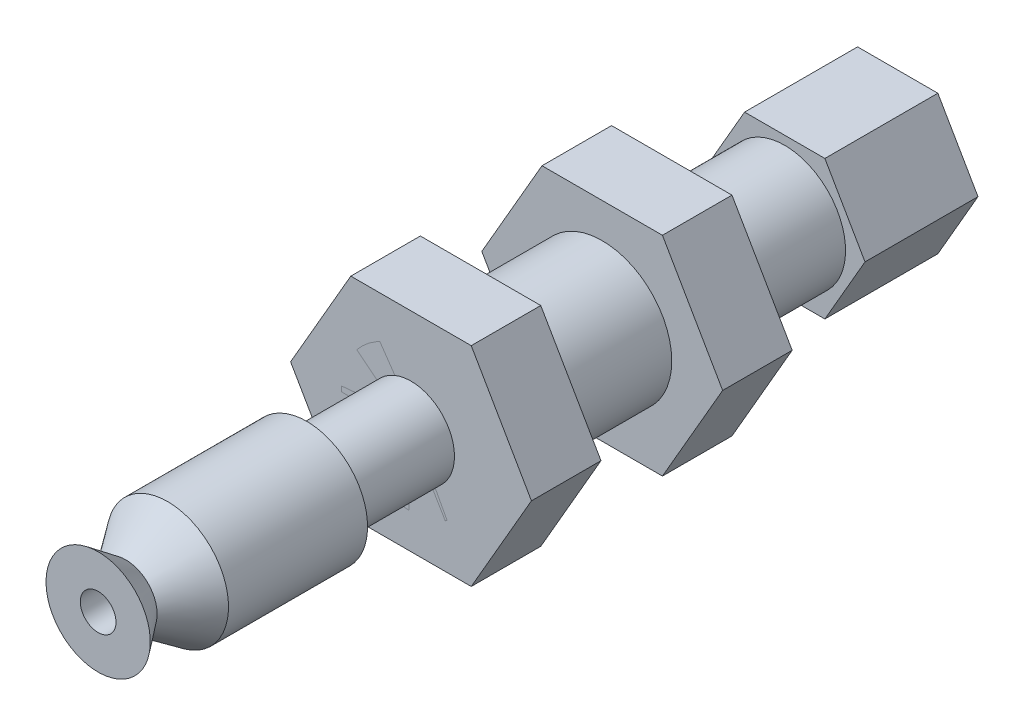
from build123d import *

# Parameters (mm, degrees)
SKETCH_1_R          = 3.5
EXTRUDE_1_DEPTH     = 6.5
EXTRUDE_2_DEPTH     = 6.5
SKETCH_3_R          = 4
EXTRUDE_3_DEPTH     = 15
EXTRUDE_4_DEPTH     = 4
EXTRUDE_5_DEPTH     = 4
SKETCH_6_R          = 2.5
EXTRUDE_6_DEPTH     = 6
SKETCH_10_R         = 1.026794083
CUT_EXTRUDE_1_DEPTH = 47.904157598


with BuildPart() as part:
    # 草图1 → 凸台-拉伸1 (new body)
    with BuildSketch(Plane.XY):
        Circle(SKETCH_1_R)
    extrude(amount=EXTRUDE_1_DEPTH)

    # 草图2 → 凸台-拉伸2 (add)
    with BuildSketch(Plane(origin=(0, 0, 0), x_dir=(-1, 0, 0), z_dir=(0, 0, -1))):
        Polygon((-4.618802154, 0), (-2.309401077, -4), (2.309401077, -4), (4.618802154, 0), (2.309401077, 4), (-2.309401077, 4), align=None)
    extrude(amount=EXTRUDE_2_DEPTH)

    # 草图3 → 凸台-拉伸3 (add)
    with BuildSketch(Plane.XY.offset(6.5)):
        Circle(SKETCH_3_R)
    extrude(amount=EXTRUDE_3_DEPTH)


with BuildPart() as body_2:
    # 草图4 → 凸台-拉伸4 (new body)
    with BuildSketch(Plane(origin=(0, 0, 6.5), x_dir=(-1, 0, 0), z_dir=(0, 0, -1))):
        Polygon((-3.464101615, 6), (-6.92820323, 0), (-3.464101615, -6), (3.464101615, -6), (6.92820323, 0), (3.464101615, 6), align=None)
    extrude(amount=-EXTRUDE_4_DEPTH)


with BuildPart() as body_3:
    # 草图5 → 凸台-拉伸5 (new body)
    with BuildSketch(Plane.XY.offset(21.5)):
        Polygon((3.464101615, 6), (-3.464101615, 6), (-6.92820323, 0), (-3.464101615, -6), (3.464101615, -6), (6.92820323, 0), align=None)
    extrude(amount=-EXTRUDE_5_DEPTH)


with BuildPart() as body_4:
    # 草图6 → 凸台-拉伸6 (new body)
    with BuildSketch(Plane.XY.offset(21.5)):
        Circle(SKETCH_6_R)
    extrude(amount=EXTRUDE_6_DEPTH)


with BuildPart() as body_5:
    # 草图7 → 旋转1 (revolve)
    with BuildSketch(Plane(origin=(0, 0, 0), x_dir=(1, 0, 0), z_dir=(0, 1, 0))):
        Polygon((0, -27.5), (0, -39.5), (3, -39.5), (1.8, -37.90681576), (3.5, -35.5), (3.5, -27.5), align=None)
    revolve(axis=Axis((0, 0, 27.5), (0, 0, 1)))


with BuildPart() as hole_wizard_m5_1_tool:
    # 草图8 → M5 螺纹孔1 (revolve)
    with BuildSketch(Plane(origin=(0, 0, -6.5), x_dir=(0, 1, 0), z_dir=(1, 0, 0))):
        Polygon((0, 0), (0, 13.6618073), (2.1, 12.4), (2.1, 0), align=None)
    revolve(axis=Axis((0, 0, -12.85), (0, 0, 1)))


with BuildPart() as part_1:
    add(part.part)

    # M5 螺纹孔1: cut by hole_wizard_m5_1_tool
    add(hole_wizard_m5_1_tool.part, mode=Mode.SUBTRACT)


with BuildPart() as body_2_1:
    add(body_2.part)

    # M5 螺纹孔1: cut by hole_wizard_m5_1_tool
    add(hole_wizard_m5_1_tool.part, mode=Mode.SUBTRACT)


with BuildPart() as cut_extrude_1_tool:
    # 草图10 → 切除-拉伸1 (new, through all)
    with BuildSketch(Plane.XY.offset(39.5)):
        Circle(SKETCH_10_R)
    extrude(amount=-CUT_EXTRUDE_1_DEPTH)


with BuildPart() as part_2:
    add(part_1.part)

    # 切除-拉伸1: cut by cut_extrude_1_tool
    add(cut_extrude_1_tool.part, mode=Mode.SUBTRACT)


with BuildPart() as body_2_2:
    add(body_2_1.part)

    # 切除-拉伸1: cut by cut_extrude_1_tool
    add(cut_extrude_1_tool.part, mode=Mode.SUBTRACT)


with BuildPart() as body_3_1:
    add(body_3.part)

    # 切除-拉伸1: cut by cut_extrude_1_tool
    add(cut_extrude_1_tool.part, mode=Mode.SUBTRACT)


with BuildPart() as body_4_1:
    add(body_4.part)

    # 切除-拉伸1: cut by cut_extrude_1_tool
    add(cut_extrude_1_tool.part, mode=Mode.SUBTRACT)


with BuildPart() as body_5_1:
    add(body_5.part)

    # 切除-拉伸1: cut by cut_extrude_1_tool
    add(cut_extrude_1_tool.part, mode=Mode.SUBTRACT)


solid = Compound([part_2.part, body_2_2.part, body_3_1.part, body_4_1.part, body_5_1.part])
